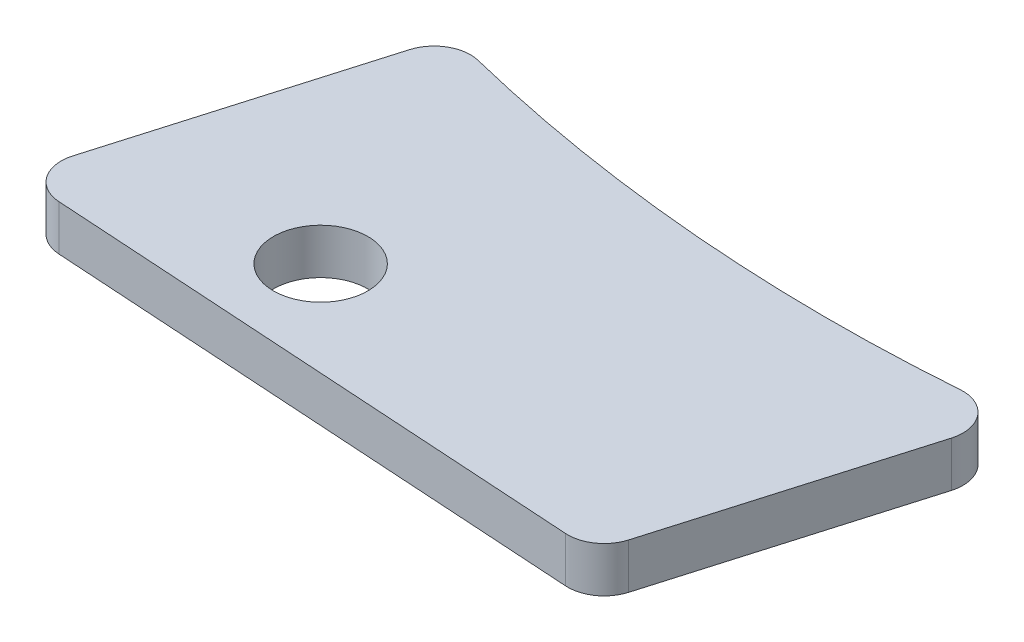
from build123d import *

# Parameters (mm, degrees)
SKETCH1_R           = 3.3
BOSS_EXTRUDE1_DEPTH = 3.175
FILLET1_R           = 2.54


with BuildPart() as part:
    # Sketch1 → Boss-Extrude1 (new body)
    with BuildSketch(Plane(origin=(0, 0, 0), x_dir=(1, 0, 0), z_dir=(0, 1, 0))):
        with BuildLine():
            Line((-48.70903707, -102.985419006), (-49.602131042, -106.032221946))
            Line((-49.602131042, -106.032221946), (-55.631977257, -126.603129099))
            Line((-55.631977257, -126.603129099), (-12.618209883, -129.313914375))
            Line((-12.618209883, -129.313914375), (-6.890929076, -109.775213464))
            Line((-6.890929076, -109.775213464), (-5.88465666, -106.342300635))
            ThreePointArc((-5.88465666, -106.342300635), (-27.452664405, -106.651653953), (-48.70903707, -102.985419006))
        make_face()
        with Locations(Location((-39.544579652, -121.411764721, 0), (0, 0, 270))):
            Circle(SKETCH1_R, mode=Mode.SUBTRACT)
    extrude(amount=BOSS_EXTRUDE1_DEPTH)

    # Fillet1
    fillet1_edges = [part.edges().sort_by_distance(p)[0] for p in [
        (-5.88465666, 1.5875, 106.342300635),
        (-12.618209883, 1.5875, 129.313914375),
        (-55.631977257, 1.5875, 126.603129099),
        (-48.70903707, 1.5875, 102.985419006),
    ]]
    fillet(fillet1_edges, radius=FILLET1_R)


solid = part.part
